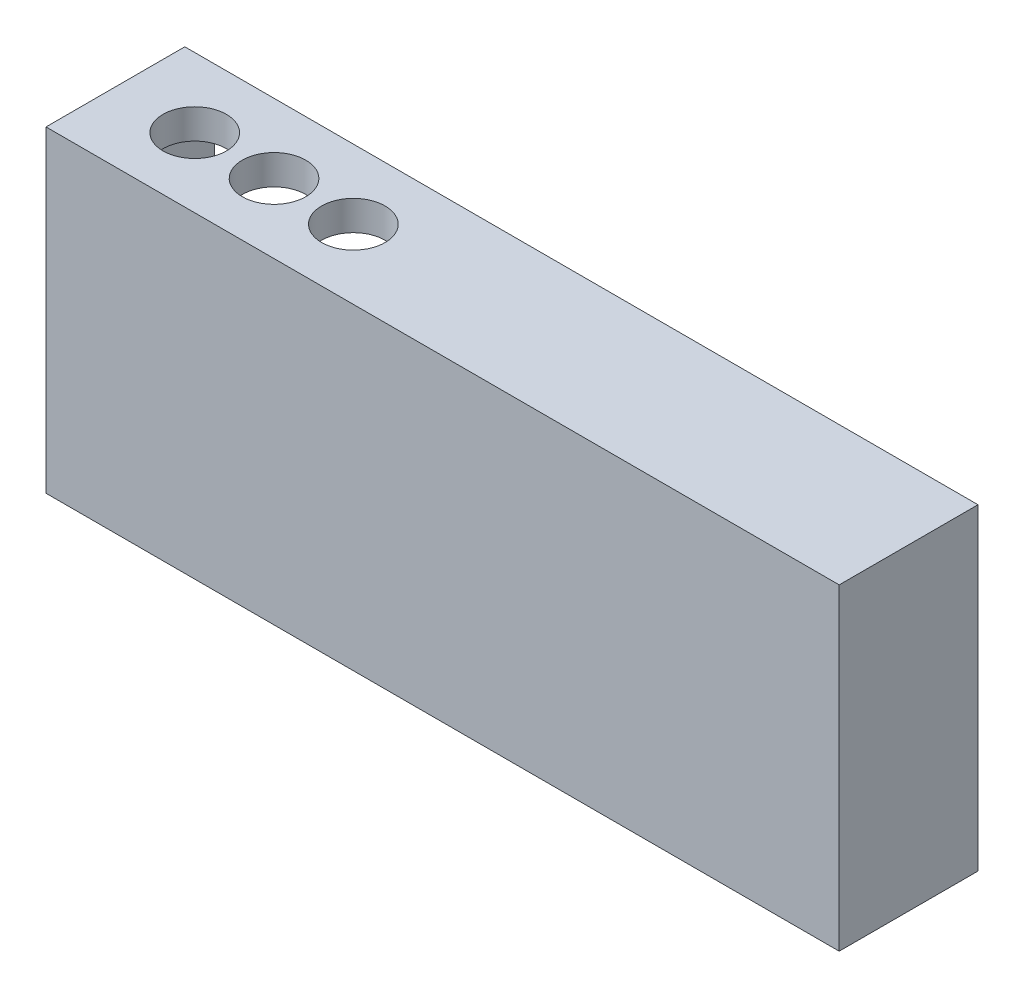
from build123d import *

# Parameters (mm, degrees)
CROQUIS1_W              = 200
CROQUIS1_H              = 80
SALIENTE_EXTRUIR1_DEPTH = 35
CROQUIS2_W              = 185
CROQUIS2_H              = 65
CORTAR_EXTRUIR1_DEPTH   = 27.5
CROQUIS3_R              = 8
CORTAR_EXTRUIR2_DEPTH   = 7.5
CROQUIS4_R              = 5.4
CORTAR_EXTRUIR3_DEPTH   = 7.5
CROQUIS5_R              = 2.50919292
CORTAR_EXTRUIR4_DEPTH   = 2


with BuildPart() as part:
    # Croquis1 → Saliente-Extruir1 (new body)
    with BuildSketch(Plane.XY):
        Rectangle(CROQUIS1_W, CROQUIS1_H)
    extrude(amount=SALIENTE_EXTRUIR1_DEPTH)

    # Croquis2 → Cortar-Extruir1 (cut)
    with BuildSketch(Plane(origin=(0, 0, 0), x_dir=(-1, 0, 0), z_dir=(0, 0, -1))):
        Rectangle(CROQUIS2_W, CROQUIS2_H)
    extrude(amount=-CORTAR_EXTRUIR1_DEPTH, mode=Mode.SUBTRACT)

    # Croquis3 → Cortar-Extruir2 (cut)
    with BuildSketch(Plane(origin=(0, 40, 0), x_dir=(1, 0, 0), z_dir=(0, 1, 0))):
        with Locations(Location((-80, -17.5, 0), (0, 0, 270))):
            Circle(CROQUIS3_R)
        with Locations(Location((-60, -17.5, 0), (0, 0, 270))):
            Circle(CROQUIS3_R)
        with Locations(Location((-40, -17.5, 0), (0, 0, 270))):
            Circle(CROQUIS3_R)
    extrude(amount=-CORTAR_EXTRUIR2_DEPTH, mode=Mode.SUBTRACT)

    # Croquis4 → Cortar-Extruir3 (cut)
    with BuildSketch(Plane.XZ.offset(40)):
        with Locations(Location((80, 17.5, 0), (0, 0, 270))):
            Circle(CROQUIS4_R)
    extrude(amount=-CORTAR_EXTRUIR3_DEPTH, mode=Mode.SUBTRACT)

    # Croquis5 → Cortar-Extruir4 (cut)
    with BuildSketch(Plane(origin=(0, 0, 0), x_dir=(-1, 0, 0), z_dir=(0, 0, -1))):
        with Locations((96.25, -36.25)):
            Circle(CROQUIS5_R)
        with Locations((96.25, 36.25)):
            Circle(CROQUIS5_R)
        with Locations((-96.25, 36.25)):
            Circle(CROQUIS5_R)
        with Locations((-96.25, -36.25)):
            Circle(CROQUIS5_R)
    extrude(amount=-CORTAR_EXTRUIR4_DEPTH, mode=Mode.SUBTRACT)


solid = part.part
